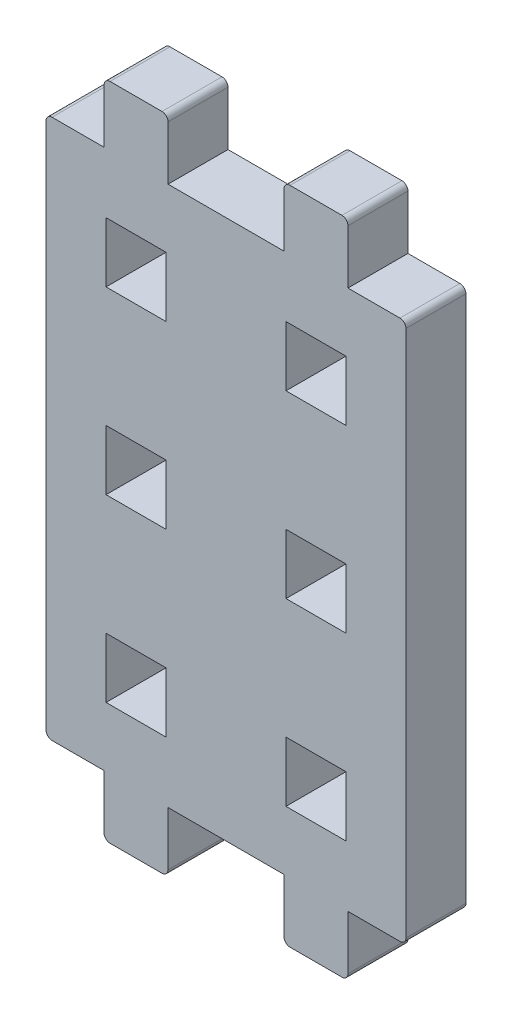
from build123d import *

# Parameters (mm, degrees)
MODEL_W                 = 3
MODEL_H                 = 3
SALIENTE_EXTRUIR1_DEPTH = 3


with BuildPart() as part:
    # Model → Saliente-Extruir1 (new body)
    with BuildSketch(Plane.XY):
        with BuildLine():
            Line((9.216868636, 295.636684928), (9.216868636, 269.236684928))
            ThreePointArc((9.216868636, 269.236684928), (9.304736602, 269.024552894), (9.516868636, 268.936684928))
            Line((9.516868636, 268.936684928), (12.116868636, 268.936684928))
            Line((12.116868636, 268.936684928), (12.116868636, 266.236684928))
            ThreePointArc((12.116868636, 266.236684928), (12.204736602, 266.024552894), (12.416868637, 265.936684928))
            Line((12.416868637, 265.936684928), (15.016868636, 265.936684928))
            ThreePointArc((15.016868636, 265.936684928), (15.229000671, 266.024552894), (15.316868637, 266.236684928))
            Line((15.316868637, 266.236684928), (15.316868637, 268.936684928))
            Line((15.316868637, 268.936684928), (21.116868637, 268.936684928))
            Line((21.116868637, 268.936684928), (21.116868637, 266.236684928))
            ThreePointArc((21.116868637, 266.236684928), (21.204736602, 266.024552894), (21.416868637, 265.936684928))
            Line((21.416868637, 265.936684928), (24.016868636, 265.936684928))
            ThreePointArc((24.016868636, 265.936684928), (24.229000671, 266.024552894), (24.316868637, 266.236684928))
            Line((24.316868637, 266.236684928), (24.316868637, 268.936684928))
            Line((24.316868637, 268.936684928), (26.916868636, 268.936684928))
            ThreePointArc((26.916868636, 268.936684928), (27.129000671, 269.024552894), (27.216868636, 269.236684928))
            Line((27.216868636, 269.236684928), (27.216868636, 295.636684928))
            ThreePointArc((27.216868636, 295.636684928), (27.129000671, 295.848816963), (26.916868636, 295.936684928))
            Line((26.916868636, 295.936684928), (24.316868637, 295.936684928))
            Line((24.316868637, 295.936684928), (24.316868637, 298.636684928))
            ThreePointArc((24.316868637, 298.636684928), (24.229000671, 298.848816963), (24.016868636, 298.936684928))
            Line((24.016868636, 298.936684928), (21.416868637, 298.936684928))
            ThreePointArc((21.416868637, 298.936684928), (21.204736602, 298.848816963), (21.116868637, 298.636684928))
            Line((21.116868637, 298.636684928), (21.116868637, 295.936684928))
            Line((21.116868637, 295.936684928), (15.316868637, 295.936684928))
            Line((15.316868637, 295.936684928), (15.316868637, 298.636684928))
            ThreePointArc((15.316868637, 298.636684928), (15.229000671, 298.848816963), (15.016868636, 298.936684928))
            Line((15.016868636, 298.936684928), (12.416868637, 298.936684928))
            ThreePointArc((12.416868637, 298.936684928), (12.204736602, 298.848816963), (12.116868636, 298.636684928))
            Line((12.116868636, 298.636684928), (12.116868636, 295.936684928))
            Line((12.116868636, 295.936684928), (9.516868636, 295.936684928))
            ThreePointArc((9.516868636, 295.936684928), (9.304736602, 295.848816963), (9.216868636, 295.636684928))
        make_face()
        with Locations((13.716868636, 291.436684928)):
            Rectangle(MODEL_W, MODEL_H, mode=Mode.SUBTRACT)
        with Locations((22.716868636, 291.436684928)):
            Rectangle(MODEL_W, MODEL_H, mode=Mode.SUBTRACT)
        with Locations((13.716868636, 273.436684928)):
            Rectangle(MODEL_W, MODEL_H, mode=Mode.SUBTRACT)
        with Locations((22.716868636, 273.436684928)):
            Rectangle(MODEL_W, MODEL_H, mode=Mode.SUBTRACT)
        with Locations((13.716868636, 282.436684928)):
            Rectangle(MODEL_W, MODEL_H, mode=Mode.SUBTRACT)
        with Locations((22.716868636, 282.436684928)):
            Rectangle(MODEL_W, MODEL_H, mode=Mode.SUBTRACT)
    extrude(amount=SALIENTE_EXTRUIR1_DEPTH)


solid = part.part
